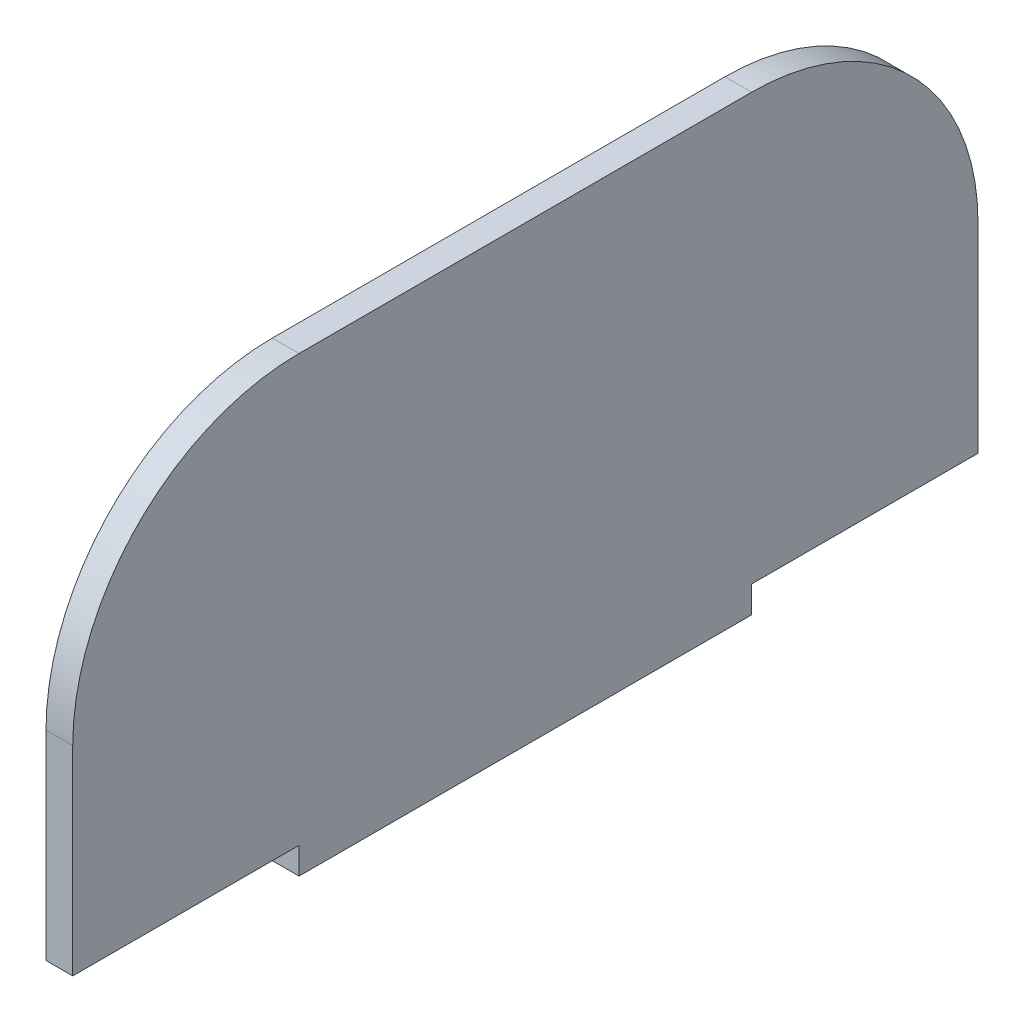
from build123d import *

# Parameters (mm, degrees)
SKETCH2_W           = 101.6
SKETCH2_H           = 50.8
BOSS_EXTRUDE1_DEPTH = 3
FILLET1_R           = 25.4
SKETCH4_W           = 25.4
SKETCH4_H           = 3
CUT_EXTRUDE1_DEPTH  = 3


with BuildPart() as part:
    # Sketch2 → Boss-Extrude1 (new body)
    with BuildSketch(Plane(origin=(0, 0, 0), x_dir=(0, 0, -1), z_dir=(1, 0, 0))):
        with Locations((50.8, 25.4)):
            Rectangle(SKETCH2_W, SKETCH2_H)
    extrude(amount=BOSS_EXTRUDE1_DEPTH)

    # Fillet1
    fillet1_edges = [part.edges().sort_by_distance(p)[0] for p in [
        (1.5, 50.8, 0),
        (1.5, 50.8, -101.6),
    ]]
    fillet(fillet1_edges, radius=FILLET1_R)

    # Sketch4 → Cut-Extrude1 (cut)
    with BuildSketch(Plane(origin=(3, 0, 0), x_dir=(0, 0, -1), z_dir=(1, 0, 0))):
        with Locations((12.7, 1.5)):
            Rectangle(SKETCH4_W, SKETCH4_H)
        with Locations((88.9, 1.5)):
            Rectangle(SKETCH4_W, SKETCH4_H)
    extrude(amount=-CUT_EXTRUDE1_DEPTH, mode=Mode.SUBTRACT)


solid = part.part
